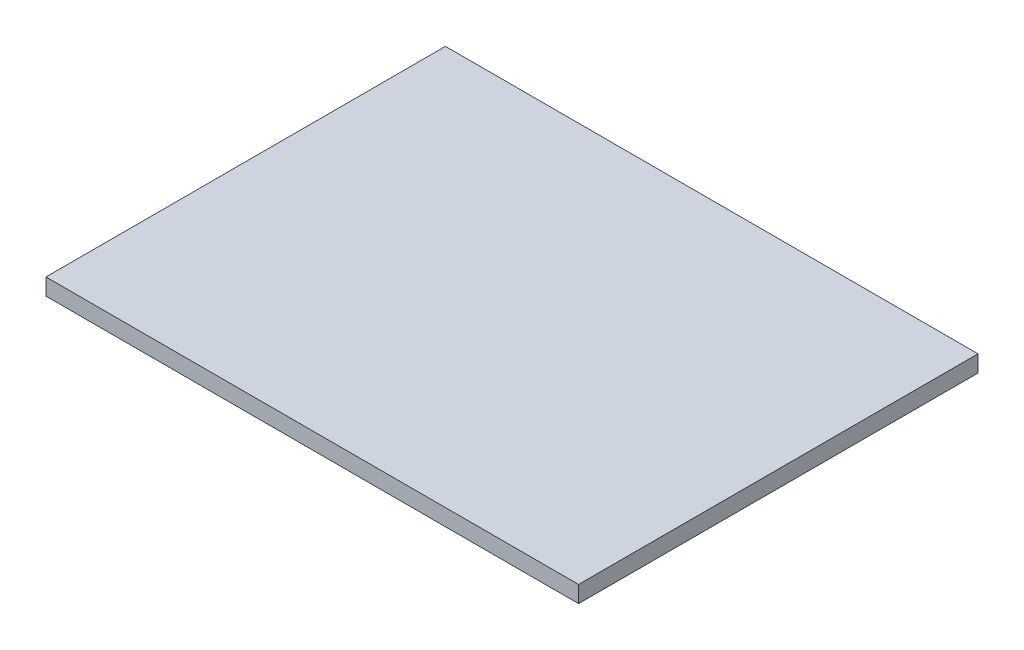
from build123d import *

# Parameters (mm, degrees)
SKETCH1_W           = 32
SKETCH1_H           = 24
BOSS_EXTRUDE1_DEPTH = 1


with BuildPart() as part:
    # Sketch1 → Boss-Extrude1 (new body)
    with BuildSketch(Plane(origin=(0, 0, 0), x_dir=(1, 0, 0), z_dir=(0, 1, 0))):
        with Locations((-16, -12)):
            Rectangle(SKETCH1_W, SKETCH1_H)
    extrude(amount=BOSS_EXTRUDE1_DEPTH)


solid = part.part
